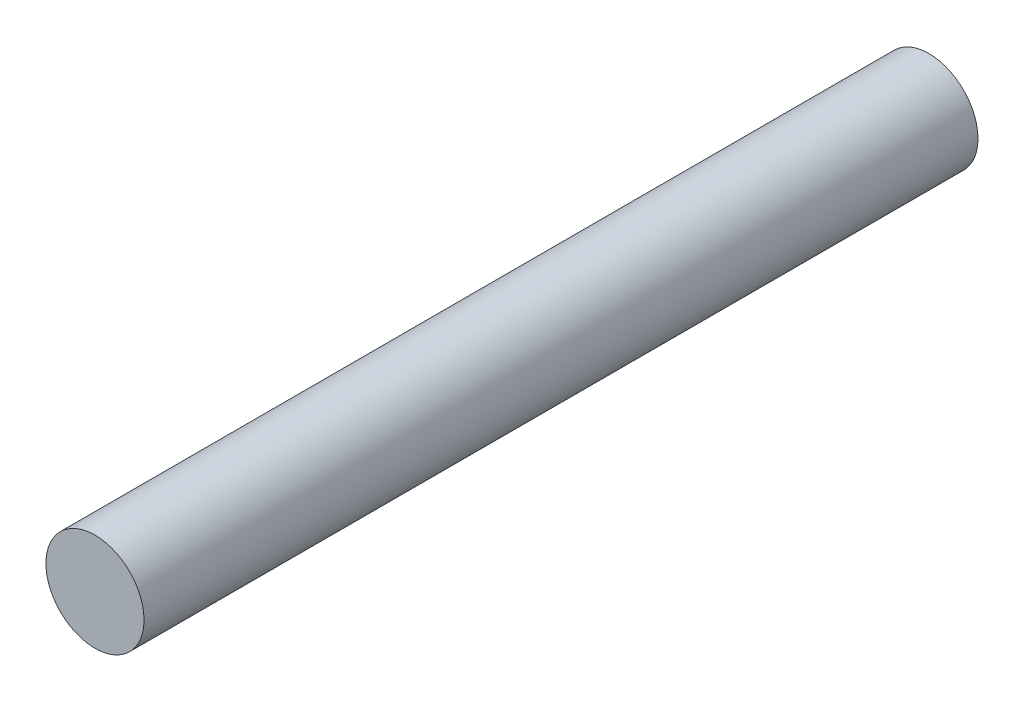
from build123d import *

# Parameters (mm, degrees)
SKETCH_1_R      = 4
EXTRUDE_1_DEPTH = 68


with BuildPart() as part:
    # 草图1 → 凸台-拉伸1 (new body)
    with BuildSketch(Plane.XY):
        Circle(SKETCH_1_R)
    extrude(amount=EXTRUDE_1_DEPTH)


solid = part.part
